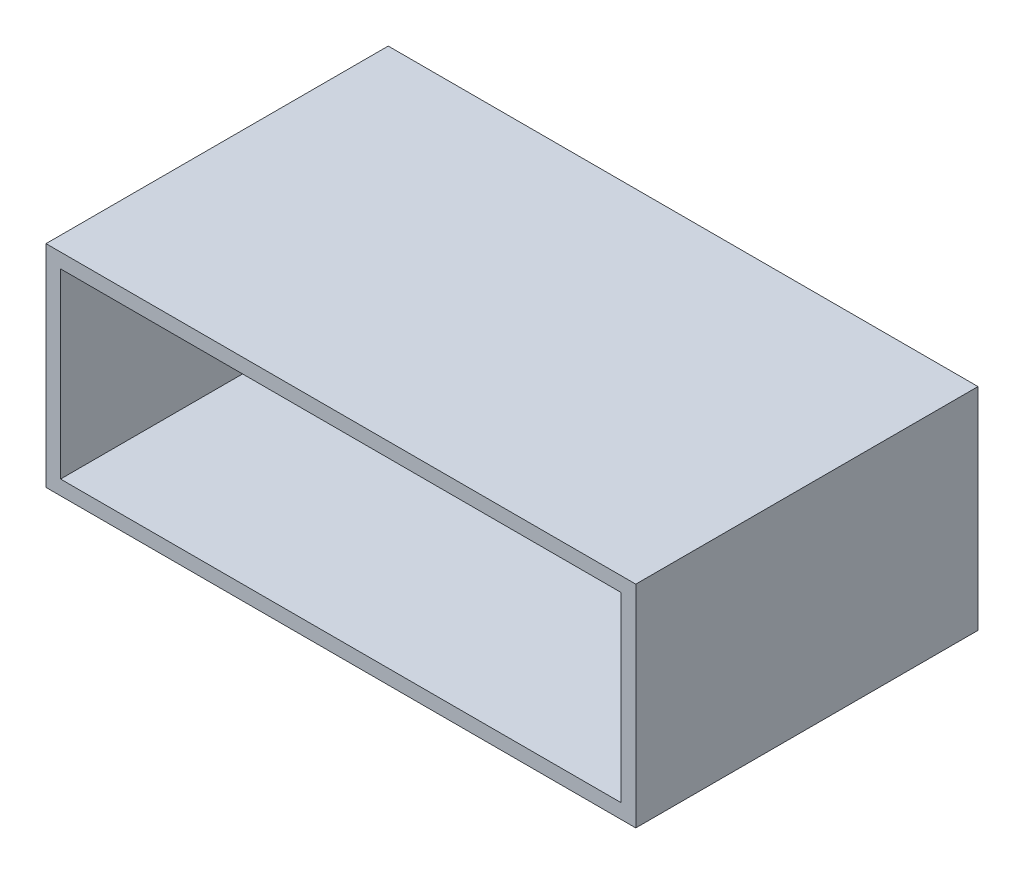
from build123d import *

# Parameters (mm, degrees)
SKETCH1_W     = 81
SKETCH1_H     = 29
SKETCH1_W_2   = 77
SKETCH1_H_2   = 25
PROFILE_DEPTH = 47
SKETCH2_W     = 77
SKETCH2_H     = 25
BACK_DEPTH    = 2


with BuildPart() as part:
    # Sketch1 → Profile (new body)
    with BuildSketch(Plane.XY):
        with Locations((40.5, 14.5)):
            Rectangle(SKETCH1_W, SKETCH1_H)
        with Locations((40.5, 14.5)):
            Rectangle(SKETCH1_W_2, SKETCH1_H_2, mode=Mode.SUBTRACT)
    extrude(amount=PROFILE_DEPTH)

    # Sketch2 → Back (add)
    with BuildSketch(Plane.XY):
        with Locations((40.5, 14.5)):
            Rectangle(SKETCH2_W, SKETCH2_H)
    extrude(amount=BACK_DEPTH)


solid = part.part
